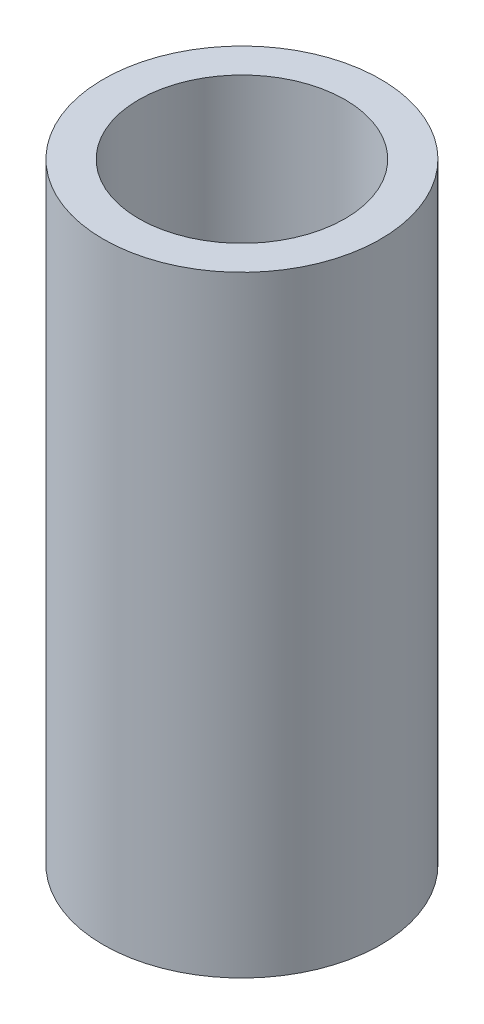
from build123d import *

# Parameters (mm, degrees)
SKETCH1_R           = 1.5875
BOSS_EXTRUDE1_DEPTH = 3.5
SKETCH3_R           = 1.1811
CUT_EXTRUDE1_DEPTH  = 8.351211635


with BuildPart() as part:
    # Sketch1 → Boss-Extrude1 (new, symmetric)
    with BuildSketch(Plane(origin=(0, 0, 0), x_dir=(1, 0, 0), z_dir=(0, 1, 0))):
        with Locations(Location((0, 0, 0), (0, 0, 270))):
            Circle(SKETCH1_R)
    extrude(amount=BOSS_EXTRUDE1_DEPTH, both=True)

    # Sketch3 → Cut-Extrude1 (cut, through all)
    with BuildSketch(Plane(origin=(0, 3.5, 0), x_dir=(1, 0, 0), z_dir=(0, 1, 0))):
        with Locations(Location((0, 0, 0), (0, 0, 270))):
            Circle(SKETCH3_R)
    extrude(amount=-CUT_EXTRUDE1_DEPTH, mode=Mode.SUBTRACT)


solid = part.part
